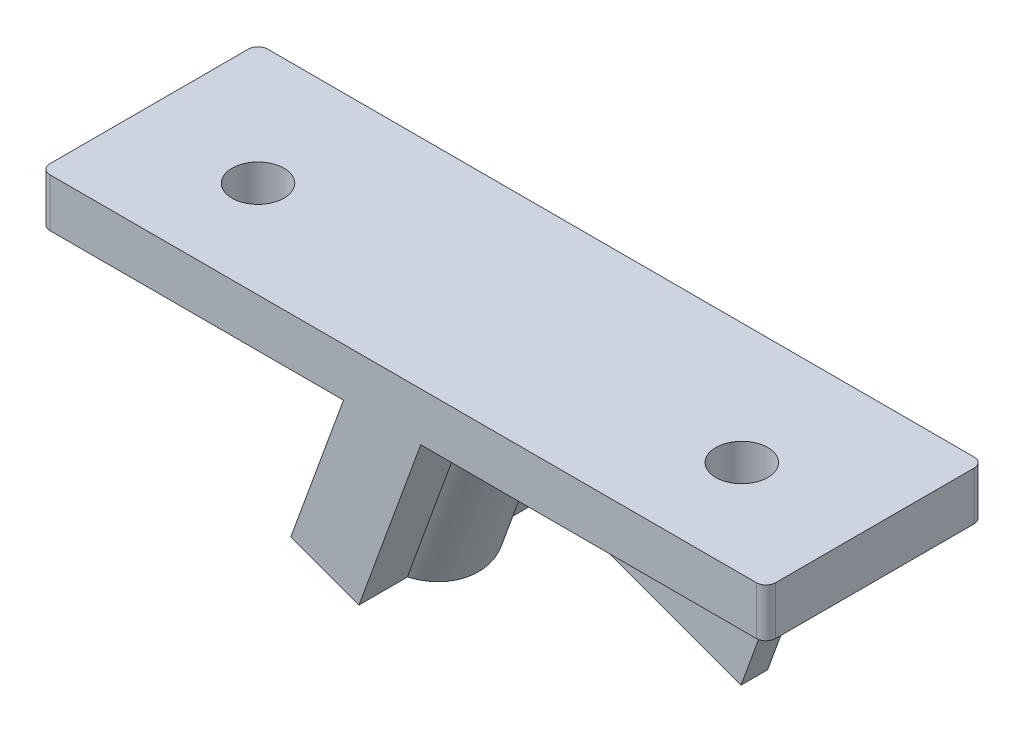
from build123d import *

# Parameters (mm, degrees)
SKETCH_1_W      = 60
SKETCH_1_H      = 18
SKETCH_1_R      = 2.15
EXTRUDE_1_DEPTH = 4
EXTRUDE_3_DEPTH = 2.2
FILLET_1_R      = 0.8
EXTRUDE_4_DEPTH = 15.801607137


with BuildPart() as part:
    # 草图1 → 凸台-拉伸1 (new body)
    with BuildSketch(Plane(origin=(0, 0, 0), x_dir=(1, 0, 0), z_dir=(0, 1, 0))):
        with Locations((0, 9)):
            Rectangle(SKETCH_1_W, SKETCH_1_H)
        with Locations(Location((-20, 8, 0), (0, 0, 270))):
            Circle(SKETCH_1_R, mode=Mode.SUBTRACT)
        with Locations(Location((20, 8, 0), (0, 0, 270))):
            Circle(SKETCH_1_R, mode=Mode.SUBTRACT)
    extrude(amount=EXTRUDE_1_DEPTH)

    # 草图5 → 凸台-拉伸3 (add)
    with BuildSketch(Plane(origin=(0, 0, -18), x_dir=(-1, 0, 0), z_dir=(0, 0, -1))):
        Polygon((-19.332346445, 0), (10.038960076, 0), (13.801181652, -10.336618829), (-12.134334681, -19.776374784), align=None)
    extrude(amount=-EXTRUDE_3_DEPTH)

    # 圆角1
    fillet_1_edges = [part.edges().sort_by_distance(p)[0] for p in [
        (-30, 2, -18),
        (30, 2, -18),
        (30, 2, 0),
        (-30, 2, 0),
    ]]
    fillet(fillet_1_edges, radius=FILLET_1_R)

    # 草图4 → 凸台-拉伸4 (add)
    with BuildSketch(Plane(origin=(0.467911114, 1.285575219, 0), x_dir=(0, 0, -1), z_dir=(0.34202014332566943, 0.9396926207859081, 0))):
        with BuildLine():
            Line((0, 4.633536704), (4, 4.633536704))
            ThreePointArc((4, 4.633536704), (8, 6.633536704), (12, 4.633536704))
            Line((12, 4.633536704), (18, 4.633536704))
            Line((18, 4.633536704), (18, -1.366463296))
            Line((18, -1.366463296), (12, -1.366463296))
            ThreePointArc((12, -1.366463296), (8, -3.366463296), (4, -1.366463296))
            Line((4, -1.366463296), (0, -1.366463296))
            Line((0, -1.366463296), (0, 4.633536704))
        make_face()
    extrude(amount=-EXTRUDE_4_DEPTH)


solid = part.part
